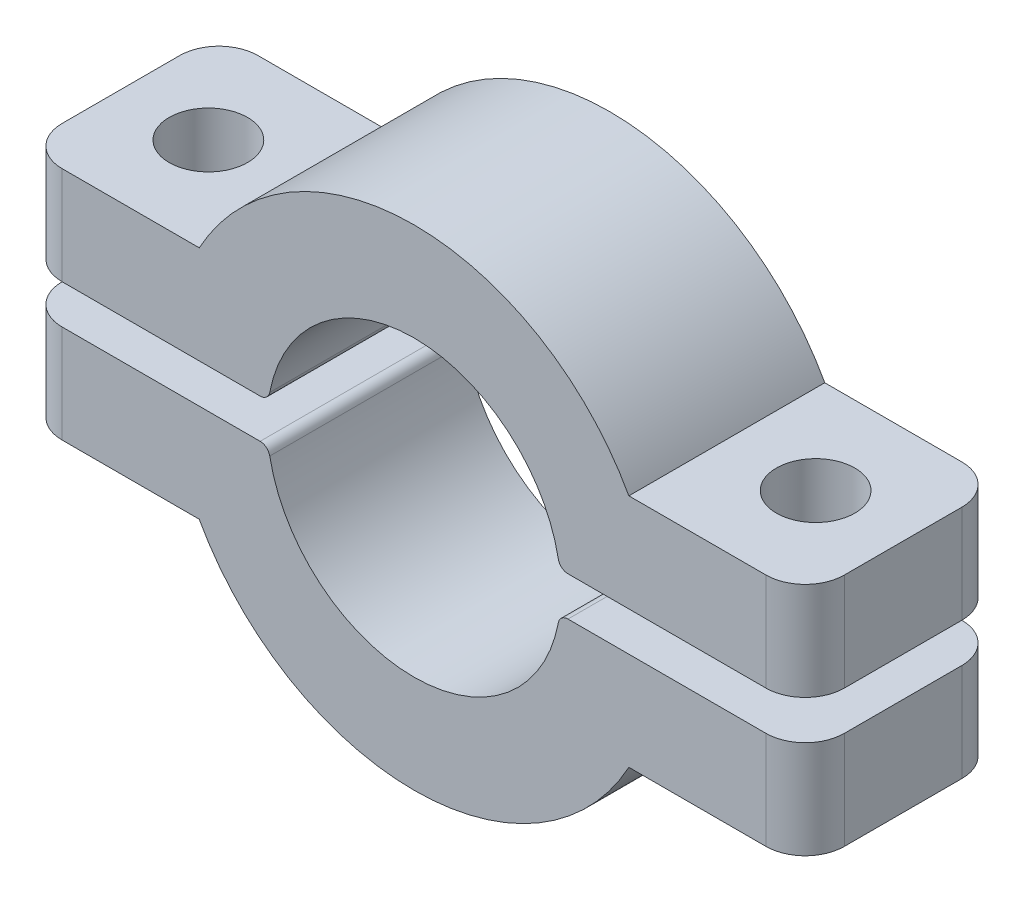
from build123d import *

# Parameters (mm, degrees)
BOSS_EXTRUDE1_DEPTH     = 10
FILLET1_R               = 2
FILLET3_R               = 0.5
CUT_EXTRUDE1_DEPTH      = 26.590728981
CUT_EXTRUDE1_DEPTH_BACK = 26.590728981
SKETCH3_R               = 2


with BuildPart() as part:
    # Sketch1 → Boss-Extrude1 (new body)
    with BuildSketch(Plane.XY):
        with BuildLine():
            Line((-19.9658561, 1), (-7.433034374, 1))
            ThreePointArc((-7.433034374, 1), (0, 7.5), (7.433034374, 1))
            Line((7.433034374, 1), (19.9658561, 1))
            Line((19.9658561, 1), (19.9658561, 6))
            Line((19.9658561, 6), (10.9658561, 6))
            ThreePointArc((10.9658561, 6), (0, 12.5), (-10.9658561, 6))
            Line((-10.9658561, 6), (-19.9658561, 6))
            Line((-19.9658561, 6), (-19.9658561, 1))
        make_face()
    extrude(amount=BOSS_EXTRUDE1_DEPTH)

    # Fillet1
    fillet1_edges = [part.edges().sort_by_distance(p)[0] for p in [
        (-19.9658561, 3.5, 0),
        (19.9658561, 3.5, 10),
        (-19.9658561, 3.5, 10),
        (19.9658561, 3.5, 0),
    ]]
    fillet(fillet1_edges, radius=FILLET1_R)

    # Fillet3
    fillet3_edges = [part.edges().sort_by_distance(p)[0] for p in [
        (7.433034374, 1, 5),
        (-7.433034374, 1, 5),
    ]]
    fillet(fillet3_edges, radius=FILLET3_R)


with BuildPart() as body_2:
    # Mirror3: mirrored copy
    add(part.part.mirror(Plane.ZX))


with BuildPart() as cut_extrude1_tool:
    # Sketch3 → Cut-Extrude1 (new, two sides: drawn at the far end of the back side and taken through both)
    with BuildSketch(Plane(origin=(0, 0, 0), x_dir=(1, 0, 0), z_dir=(0, 1, 0)).offset(-CUT_EXTRUDE1_DEPTH_BACK)):
        with Locations(Location((-15.5, -5, 0), (0, 0, 270))):
            Circle(SKETCH3_R)
        with Locations(Location((15.5, -5, 0), (0, 0, 270))):
            Circle(SKETCH3_R)
    extrude(amount=CUT_EXTRUDE1_DEPTH + CUT_EXTRUDE1_DEPTH_BACK)


with BuildPart() as part_1:
    add(part.part)

    # Cut-Extrude1: cut by cut_extrude1_tool
    add(cut_extrude1_tool.part, mode=Mode.SUBTRACT)


with BuildPart() as body_2_1:
    add(body_2.part)

    # Cut-Extrude1: cut by cut_extrude1_tool
    add(cut_extrude1_tool.part, mode=Mode.SUBTRACT)


solid = Compound([part_1.part, body_2_1.part])
